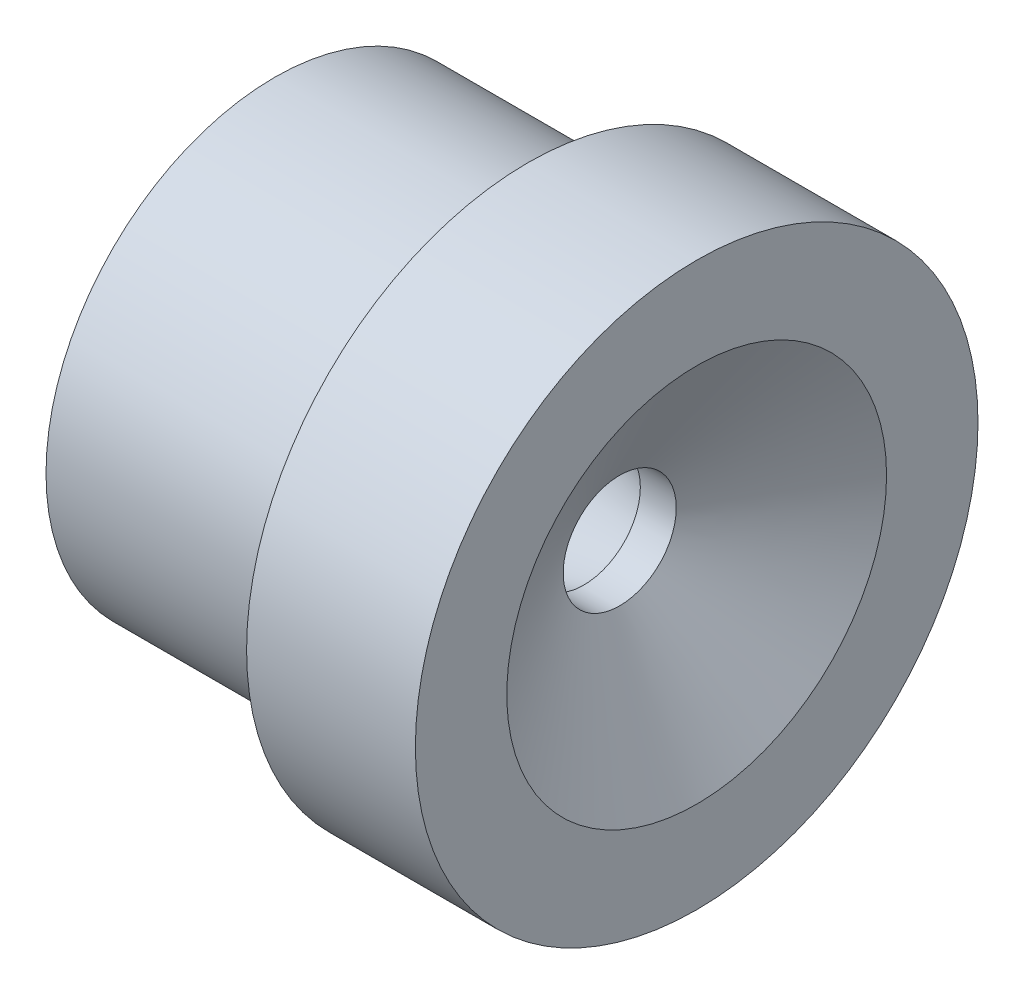
from build123d import *


with BuildPart() as part:
    # Sketch1 → Revolve1 (revolve)
    with BuildSketch(Plane(origin=(0, 0, 0), x_dir=(1, 0, 0), z_dir=(0, 1, 0)), mode=Mode.PRIVATE) as revolve1_sk:
        Polygon((0, 0), (0, 4.1275), (-3.47553315, 10.1473), (-5.09605315, 10.1473), (-19.05, 6.40835121), (-19.05, 2.3749), (-7.62, 2.3749), (-7.62, 0), align=None)
    revolve(revolve1_sk.sketch.rotate(Axis((5.118729701, 0, -12.7), (-1, 0, 0)), 180), axis=Axis((5.118729701, 0, -12.7), (-1, 0, 0)))


solid = part.part
